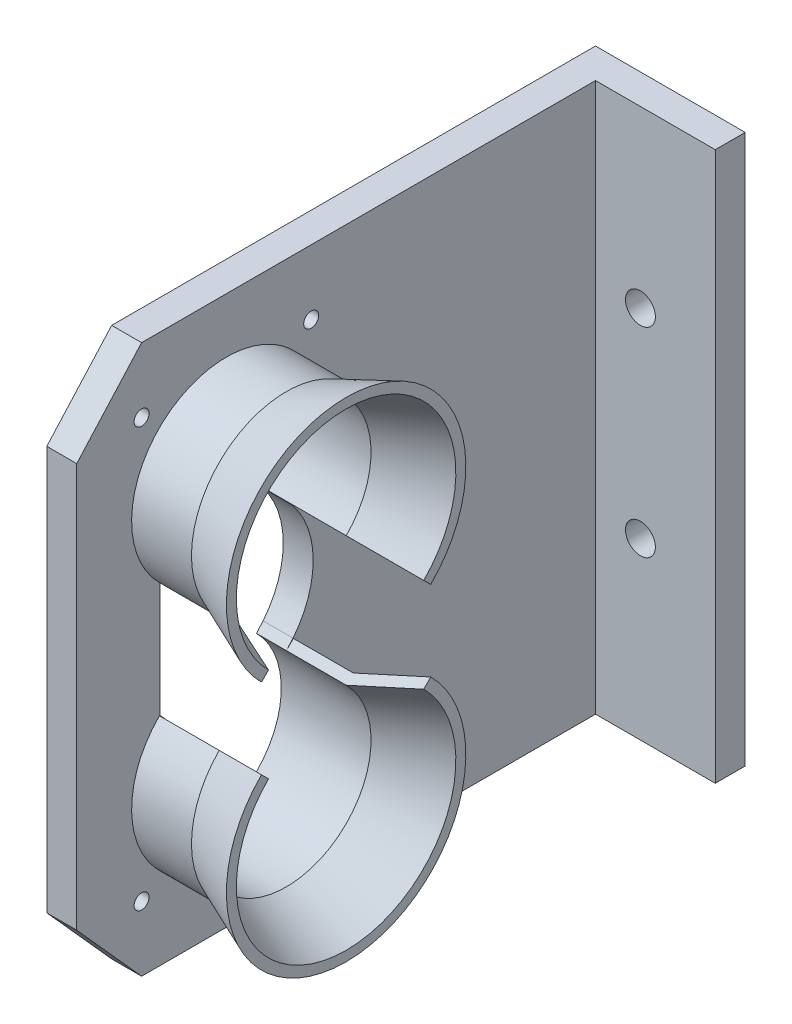
from build123d import *

# Parameters (mm, degrees)
EXTRUDE_1_DEPTH     = 27.5
SKETCH_3_R          = 0.75
CUT_EXTRUDE_3_DEPTH = 3
REVOLVE_1_ANGLE     = 270
SKETCH_2_R          = 1.5
CUT_EXTRUDE_4_DEPTH = 3


with BuildPart() as part:
    # 草图1 → 凸台-拉伸1 (new, symmetric)
    with BuildSketch(Plane(origin=(0, 0, 0), x_dir=(1, 0, 0), z_dir=(0, 1, 0))):
        Polygon((22.882352941, -27.715686275), (25.882352941, -27.715686275), (25.882352941, 24.284313725), (37.882352941, 24.284313725), (37.882352941, 27.284313725), (22.882352941, 27.284313725), align=None)
    extrude(amount=EXTRUDE_1_DEPTH, both=True)

    # 草图3 → 切除-拉伸3 (cut)
    with BuildSketch(Plane(origin=(25.882352941, 0, 0), x_dir=(0, 0, -1), z_dir=(1, 0, 0))):
        with BuildLine():
            Line((-19.394463571, 5.743970558), (-19.394463571, -5.743970558))
            Line((-19.394463571, -5.743970558), (-18.726093915, -6.48959236))
            ThreePointArc((-18.726093915, -6.48959236), (-12.715686275, -21), (-6.705278634, -6.48959236))
            Line((-6.705278634, -6.48959236), (-6.036908978, -5.743970558))
            ThreePointArc((-6.036908978, -5.743970558), (-4.017201465, 0), (-6.036908978, 5.743970558))
            Line((-6.036908978, 5.743970558), (-6.705278634, 6.48959236))
            ThreePointArc((-6.705278634, 6.48959236), (-12.715686275, 21), (-18.726093915, 6.48959236))
            Line((-18.726093915, 6.48959236), (-19.394463571, 5.743970558))
        make_face()
        Polygon((-21.215686275, 27.5), (-27.715686275, 27.5), (-27.715686275, 20.24982538), align=None)
        Polygon((-21.215686275, -27.5), (-27.715686275, -20.24982538), (-27.715686275, -27.5), align=None)
        with Locations((-4.215686275, -21)):
            Circle(SKETCH_3_R)
        with Locations((-21.215686275, -21)):
            Circle(SKETCH_3_R)
        with Locations((-4.215686275, 21)):
            Circle(SKETCH_3_R)
        with Locations((-21.215686275, 21)):
            Circle(SKETCH_3_R)
    extrude(amount=-CUT_EXTRUDE_3_DEPTH, mode=Mode.SUBTRACT)

    # 草图5 → 旋转1 (revolve, symmetric)
    with BuildSketch(Plane(origin=(0, 0, 12.715686275), x_dir=(0, -1, 0), z_dir=(0, 0, 1))) as revolve_1_sk:
        Polygon((-22, 25.882352941), (-21, 25.882352941), (-21, 31.882352941), (-23.5, 37.882352941), (-24.5, 37.882352941), (-22, 31.882352941), align=None)
    revolve_1 = revolve(axis=Axis((32.882352941, 12.5, 12.715686275), (-1, 0, 0)), revolution_arc=REVOLVE_1_ANGLE / 2)
    revolve_1 = revolve_1 + revolve(revolve_1_sk.sketch, axis=Axis((32.882352941, 12.5, 12.715686275), (1, 0, 0)), revolution_arc=REVOLVE_1_ANGLE / 2)

    # 镜向1: 旋转1 across plane
    add(revolve_1.mirror(Plane.ZX))

    # 草图2 → 切除-拉伸4 (cut)
    with BuildSketch(Plane(origin=(0, 0, -27.284313725), x_dir=(-1, 0, 0), z_dir=(0, 0, -1))):
        with Locations((-30.382352941, 10)):
            Circle(SKETCH_2_R)
        with Locations((-30.382352941, -10)):
            Circle(SKETCH_2_R)
    extrude(amount=-CUT_EXTRUDE_4_DEPTH, mode=Mode.SUBTRACT)


solid = part.part
